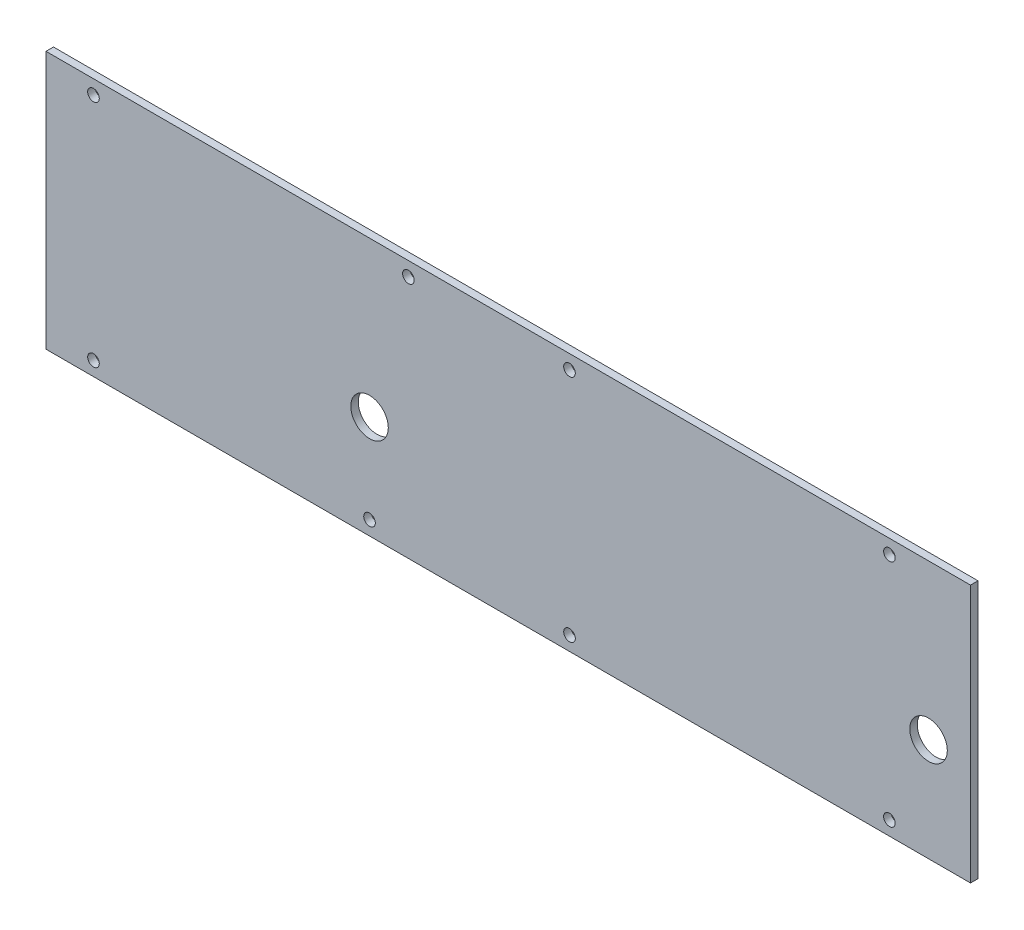
from build123d import *

# Parameters (mm, degrees)
SKETCH1_W           = 273.05
SKETCH1_H           = 76.2
BOSS_EXTRUDE1_DEPTH = 2.2098
HOLE1_D             = 3.429
HOLE2_D             = 11.0744


with BuildPart() as part:
    # Sketch1 → Boss-Extrude1 (new body)
    with BuildSketch(Plane.XY.offset(1.1049)):
        Rectangle(SKETCH1_W, SKETCH1_H)
    extrude(amount=-BOSS_EXTRUDE1_DEPTH)

    # Hole1 (through all)
    with Locations(Plane.XY.offset(1.1049)):
        with Locations((-40.9702, -33.9217), (18.0848, 33.9217), (-122.5042, -33.9217), (-122.5042, 33.9217), (-29.4894, 33.9217), (112.5728, 33.9217), (18.0848, -33.9217), (112.5728, -33.9217)):
            Hole(HOLE1_D / 2)

    # Hole2 (through all)
    with Locations(Plane.XY.offset(1.1049)):
        with Locations((-40.9702, -7.6581), (124.1298, -7.6581)):
            Hole(HOLE2_D / 2)


solid = part.part
